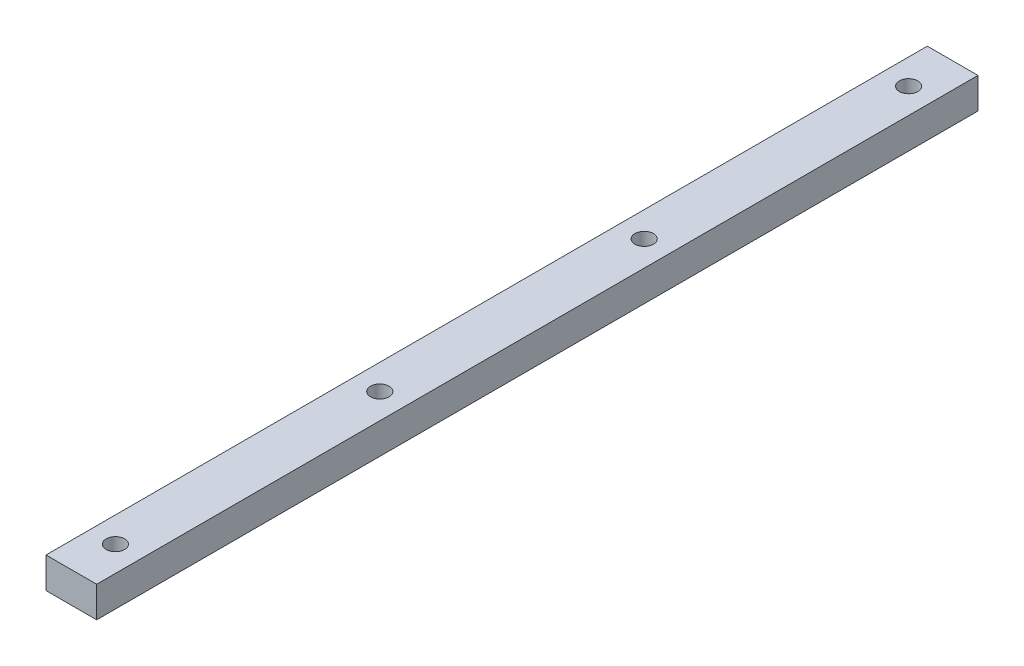
from build123d import *

# Parameters (mm, degrees)
SKETCH1_W           = 11.5
SKETCH1_H           = 7
BOSS_EXTRUDE1_DEPTH = 100
M5_TAPPED_HOLE1_D   = 4.2


with BuildPart() as part:
    # Sketch1 → Boss-Extrude1 (new, symmetric)
    with BuildSketch(Plane.XY):
        Rectangle(SKETCH1_W, SKETCH1_H)
    extrude(amount=BOSS_EXTRUDE1_DEPTH, both=True)

    # M5 Tapped Hole1 (through all)
    with Locations(Plane(origin=(0, 3.5, 0), x_dir=(1, 0, 0), z_dir=(0, 1, 0))):
        with Locations((0, 90), (0, 30), (0, -30), (0, -90)):
            Hole(M5_TAPPED_HOLE1_D / 2)


solid = part.part
